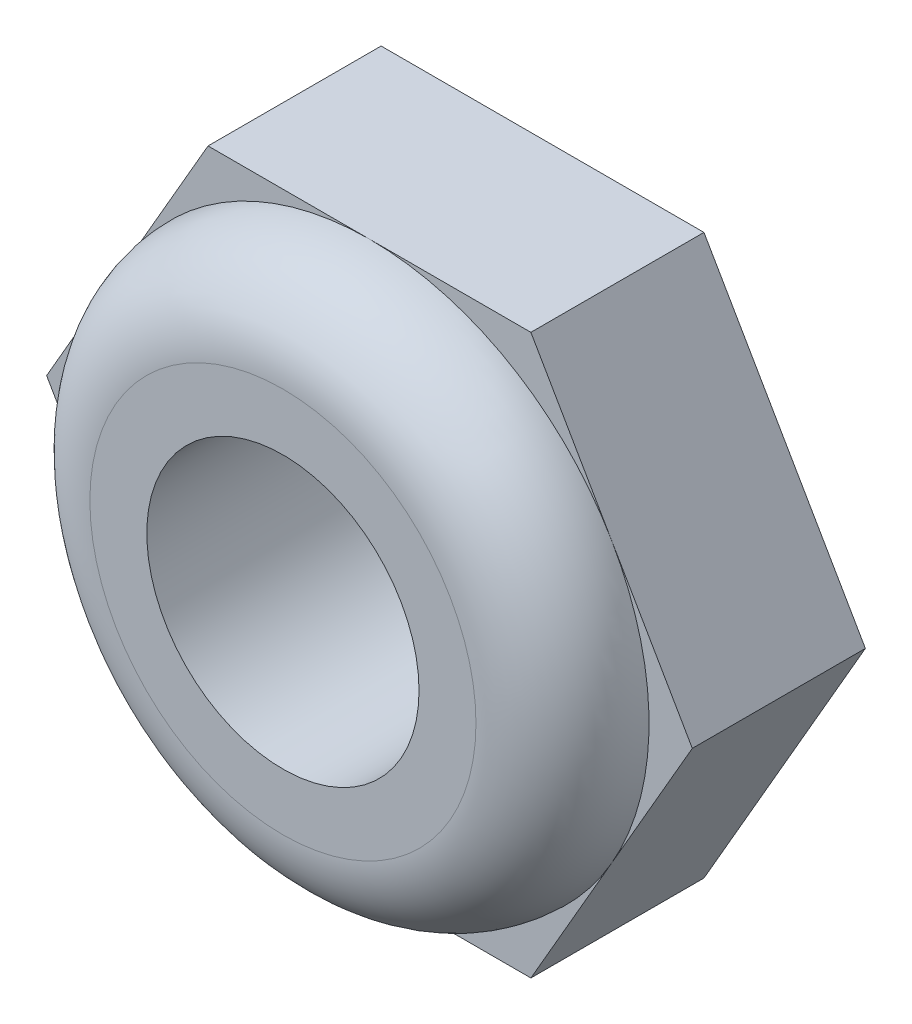
from build123d import *

# Parameters (mm, degrees)
SKETCH1_R           = 2.7051
BOSS_EXTRUDE1_DEPTH = 5.159375


with BuildPart() as part:
    # Sketch1 → Boss-Extrude1 (new body)
    with BuildSketch(Plane.XY):
        Polygon((3.207902433, 5.55625), (-3.207902433, 5.55625), (-6.415804866, 0), (-3.207902433, -5.55625), (3.207902433, -5.55625), (6.415804866, 0), align=None)
        Circle(SKETCH1_R, mode=Mode.SUBTRACT)
    extrude(amount=BOSS_EXTRUDE1_DEPTH)

    # Sketch2 → Cut-Revolve2 (revolve, cut)
    with BuildSketch(Plane(origin=(0, 0, 0), x_dir=(0, 0, -1), z_dir=(1, 0, 0))):
        with BuildLine():
            Line((-5.159375, 5.55625), (-5.159375, 3.836458333))
            ThreePointArc((-5.159375, 3.836458333), (-4.655659683, 5.052534683), (-3.439583333, 5.55625))
            Line((-3.439583333, 5.55625), (-3.439583333, 8.334375))
            Line((-3.439583333, 8.334375), (-5.159375, 8.334375))
            Line((-5.159375, 8.334375), (-5.159375, 5.55625))
        make_face()
    revolve(axis=Axis((0, 0, -0.25796875), (0, 0, 1)), mode=Mode.SUBTRACT)


solid = part.part
